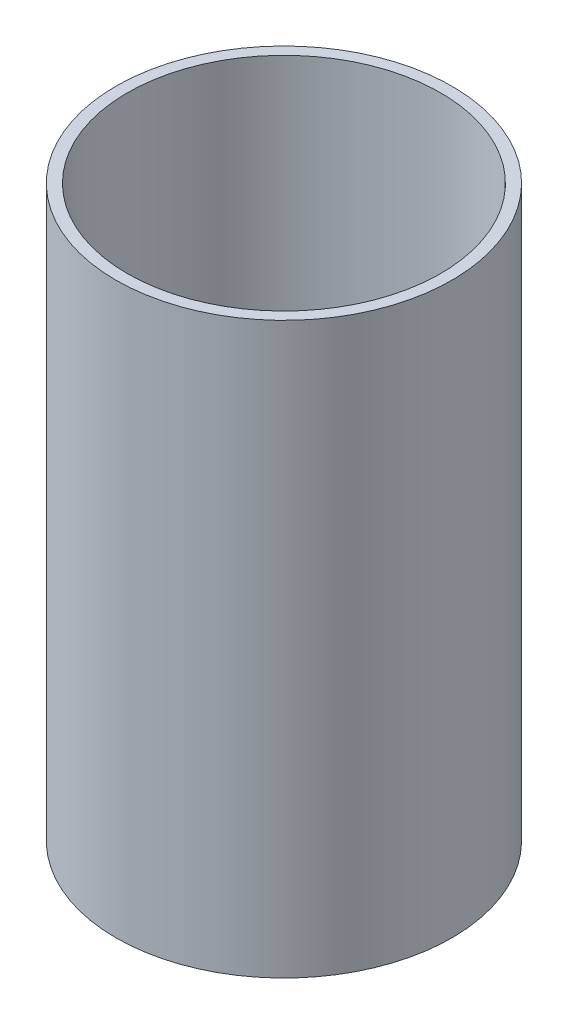
from build123d import *

# Parameters (mm, degrees)
SKETCH1_R           = 37.465
SKETCH1_R_2         = 34.925
BOSS_EXTRUDE1_DEPTH = 127


with BuildPart() as part:
    # Sketch1 → Boss-Extrude1 (new body)
    with BuildSketch(Plane(origin=(0, 0, 0), x_dir=(1, 0, 0), z_dir=(0, 1, 0))):
        with Locations(Location((0, 0, 0), (0, 0, 270))):
            Circle(SKETCH1_R)
        with Locations(Location((0, 0, 0), (0, 0, 270))):
            Circle(SKETCH1_R_2, mode=Mode.SUBTRACT)
    extrude(amount=BOSS_EXTRUDE1_DEPTH)


solid = part.part
